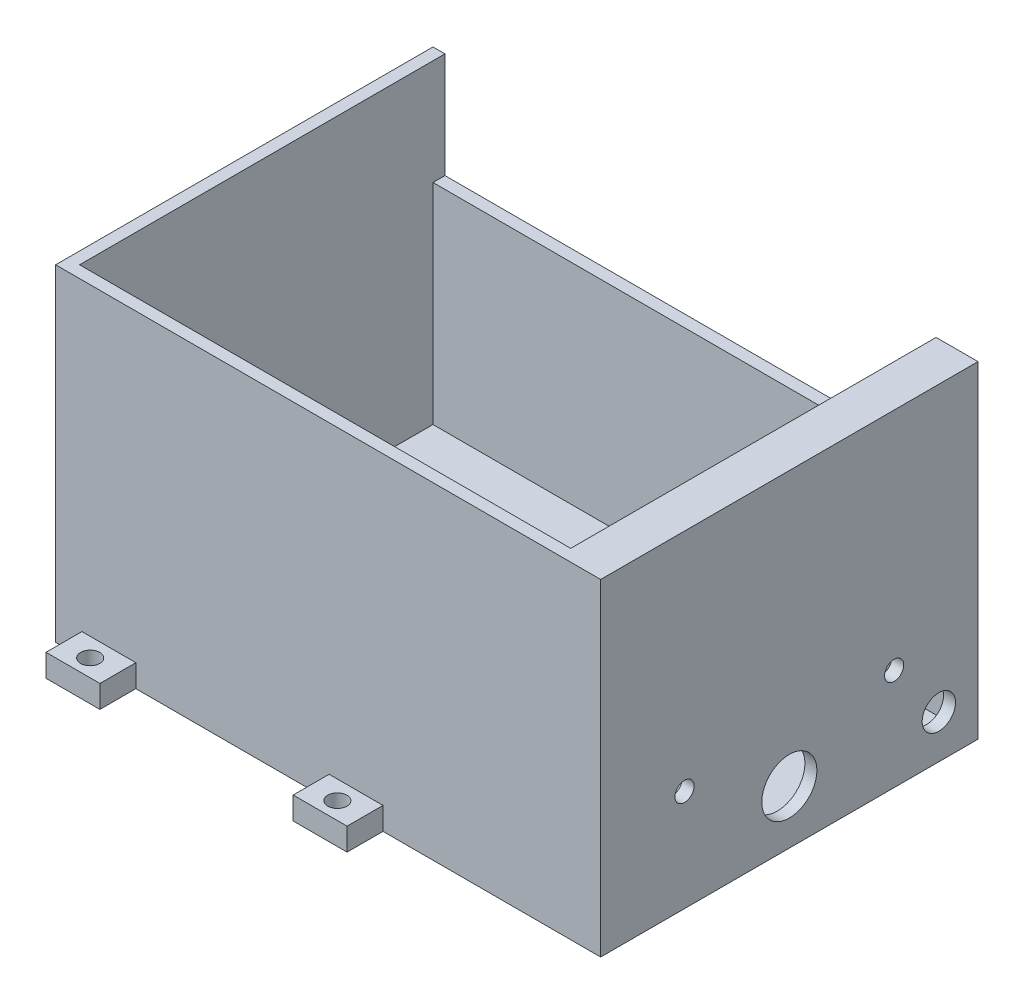
from build123d import *

# Parameters (mm, degrees)
SKETCH_1_W                = 86
SKETCH_1_H                = 63
EXTRUDE_1_DEPTH           = 2
SKETCH_2_W                = 86
SKETCH_2_H                = 63
SKETCH_2_W_2              = 82
SKETCH_2_H_2              = 59
EXTRUDE_3_DEPTH           = 52.6
SKETCH_4_W                = 82
SKETCH_4_H                = 17.6
CUT_EXTRUDE_1_DEPTH       = 52.6
SKETCH_5_R                = 1.6
SKETCH_5_R_2              = 4.6
CUT_EXTRUDE_2_DEPTH       = 2
SKETCH_7_R                = 1.6
CUT_EXTRUDE_6_DEPTH       = 2
SKETCH_8_R                = 1.6
SKETCH_8_R_2              = 1.516132991
CUT_EXTRUDE_7_DEPTH       = 2
SKETCH_9_W                = 63
SKETCH_9_H                = 54.6
EXTRUDE_4_DEPTH           = 5
SKETCH_10_R               = 1.6
SKETCH_10_R_2             = 4.6
CUT_EXTRUDE_8_DEPTH       = 5
CUT_EXTRUDE_START         = -5
SKETCH_11_R               = 1.6
SKETCH_11_R_2             = 4.6
CUT_EXTRUDE_9_DEPTH       = 5
SKETCH_12_W               = 5
SKETCH_12_H               = 15.6
EXTRUDE_5_DEPTH           = 2
SKETCH_13_R               = 2.787491564
CUT_EXTRUDE_10_DEPTH      = 2
SKETCH_14_R               = 3
CUT_EXTRUDE_11_DEPTH      = 2
SKETCH_16_W               = 9
SKETCH_16_H               = 3.75891244
SKETCH_16_H_2             = 3.76
EXTRUDE_6_DEPTH           = 6
CUT_EXTRUDE_15_DEPTH      = 80.341453127
CUT_EXTRUDE_15_DEPTH_BACK = 80.341453127
SKETCH_17_R               = 1.6
SKETCH_18_W               = 9
SKETCH_18_H               = 6
SKETCH_18_R               = 1.6
EXTRUDE_7_DEPTH           = 3.76


with BuildPart() as part:
    # 草图1 → 凸台-拉伸1 (new body)
    with BuildSketch(Plane(origin=(0, 0, 0), x_dir=(1, 0, 0), z_dir=(0, 1, 0))):
        Rectangle(SKETCH_1_W, SKETCH_1_H)
    extrude(amount=EXTRUDE_1_DEPTH)

    # 草图2 → 凸台-拉伸3 (add)
    with BuildSketch(Plane(origin=(0, 2, 0), x_dir=(1, 0, 0), z_dir=(0, 1, 0))):
        Rectangle(SKETCH_2_W, SKETCH_2_H)
        Rectangle(SKETCH_2_W_2, SKETCH_2_H_2, mode=Mode.SUBTRACT)
    extrude(amount=EXTRUDE_3_DEPTH)

    # 草图4 → 切除-拉伸1 (cut)
    with BuildSketch(Plane.XY.offset(-29.5)):
        with Locations((0, 45.8)):
            Rectangle(SKETCH_4_W, SKETCH_4_H)
    extrude(amount=-CUT_EXTRUDE_1_DEPTH, mode=Mode.SUBTRACT)

    # 草图5 → 切除-拉伸2 (cut)
    with BuildSketch(Plane(origin=(43, 0, 0), x_dir=(0, 0, -1), z_dir=(1, 0, 0))):
        with Locations((-17.5, 16.95452537)):
            Circle(SKETCH_5_R)
        with Locations((17.5, 16.95452537)):
            Circle(SKETCH_5_R)
        with Locations((0, 8.95452537)):
            Circle(SKETCH_5_R_2)
    extrude(amount=-CUT_EXTRUDE_2_DEPTH, mode=Mode.SUBTRACT)

    # 草图7 → 切除-拉伸6 (cut)
    with BuildSketch(Plane(origin=(0, 2, 0), x_dir=(1, 0, 0), z_dir=(0, 1, 0))):
        with Locations(Location((-38.17, 6.16, 0), (0, 0, 270))):
            Circle(SKETCH_7_R)
        with Locations(Location((-38.17, -26.73, 0), (0, 0, 270))):
            Circle(SKETCH_7_R)
        with Locations(Location((36.38, -26.73, 0), (0, 0, 270))):
            Circle(SKETCH_7_R)
    extrude(amount=-CUT_EXTRUDE_6_DEPTH, mode=Mode.SUBTRACT)

    # 草图8 → 切除-拉伸7 (cut)
    with BuildSketch(Plane(origin=(0, 2, 0), x_dir=(1, 0, 0), z_dir=(0, 1, 0))):
        with Locations(Location((-39, 1.715, 0), (0, 0, 270))):
            Circle(SKETCH_8_R)
        with Locations(Location((21, -22.285, 0), (0, 0, 270))):
            Circle(SKETCH_8_R)
        with Locations(Location((-39, -22.285, 0), (0, 0, 270))):
            Circle(SKETCH_8_R_2)
        with Locations(Location((21, 1.715, 0), (0, 0, 270))):
            Circle(SKETCH_8_R)
    extrude(amount=-CUT_EXTRUDE_7_DEPTH, mode=Mode.SUBTRACT)

    # 草图9 → 凸台-拉伸4 (add)
    with BuildSketch(Plane(origin=(43, 0, 0), x_dir=(0, 0, -1), z_dir=(1, 0, 0))):
        with Locations((0, 27.3)):
            Rectangle(SKETCH_9_W, SKETCH_9_H)
    extrude(amount=EXTRUDE_4_DEPTH)

    # 草图10 → 切除-拉伸8 (cut)
    with BuildSketch(Plane(origin=(48, 0, 0), x_dir=(0, 0, -1), z_dir=(1, 0, 0))):
        with Locations((-17.5, 16.95452537)):
            Circle(SKETCH_10_R)
        with Locations((0, 8.95452537)):
            Circle(SKETCH_10_R_2)
        with Locations((17.5, 16.95452537)):
            Circle(SKETCH_10_R)
    extrude(amount=-CUT_EXTRUDE_8_DEPTH, mode=Mode.SUBTRACT)

    # 草图11 → 切除-拉伸9 (cut)
    with BuildSketch(Plane.ZY.offset(-41).offset(CUT_EXTRUDE_START)):
        Polygon((29.5, 52.6), (-31.5, 52.6), (-31.5, 37), (-29.5, 37), (-29.5, 2), (29.5, 2), align=None)
        with Locations(Location((-17.5, 16.95452537, 0), (0, 0, 180))):
            Circle(SKETCH_11_R, mode=Mode.SUBTRACT)
        with Locations(Location((0, 8.95452537, 0), (0, 0, 180))):
            Circle(SKETCH_11_R_2, mode=Mode.SUBTRACT)
        with Locations(Location((17.5, 16.95452537, 0), (0, 0, 180))):
            Circle(SKETCH_11_R, mode=Mode.SUBTRACT)
    extrude(amount=CUT_EXTRUDE_9_DEPTH, mode=Mode.SUBTRACT)

    # 草图12 → 凸台-拉伸5 (add)
    with BuildSketch(Plane(origin=(0, 0, -31.5), x_dir=(-1, 0, 0), z_dir=(0, 0, -1))):
        with Locations((-43.5, 44.8)):
            Rectangle(SKETCH_12_W, SKETCH_12_H)
    extrude(amount=-EXTRUDE_5_DEPTH)

    # 草图13 → 切除-拉伸10 (cut)
    with BuildSketch(Plane(origin=(48, 0, 0), x_dir=(0, 0, -1), z_dir=(1, 0, 0))):
        with Locations((24.963130904, 7.208902204)):
            Circle(SKETCH_13_R)
    extrude(amount=-CUT_EXTRUDE_10_DEPTH, mode=Mode.SUBTRACT)

    # 草图14 → 切除-拉伸11 (cut)
    with BuildSketch(Plane(origin=(0, 0, -31.5), x_dir=(-1, 0, 0), z_dir=(0, 0, -1))):
        with Locations((-28.059363277, 7.365425106)):
            Circle(SKETCH_14_R)
    extrude(amount=-CUT_EXTRUDE_11_DEPTH, mode=Mode.SUBTRACT)

    # 草图16 → 凸台-拉伸6 (add)
    with BuildSketch(Plane(origin=(0, 0, -31.5), x_dir=(-1, 0, 0), z_dir=(0, 0, -1))):
        with Locations((34.110668407, 1.87945622)):
            Rectangle(SKETCH_16_W, SKETCH_16_H)
        with Locations((-7.158197826, 1.88)):
            Rectangle(SKETCH_16_W, SKETCH_16_H_2)
    extrude(amount=EXTRUDE_6_DEPTH)

    # 草图17 → 切除-拉伸15 (cut, two sides: drawn at the far end of the back side and taken through both)
    with BuildSketch(Plane(origin=(0, 3.75891244, 0), x_dir=(1, 0, 0), z_dir=(0, 1, 0)).offset(-CUT_EXTRUDE_15_DEPTH_BACK)):
        with Locations(Location((-34.110668407, 34.625200871, 0), (0, 0, 180))):
            Circle(SKETCH_17_R)
        with Locations(Location((7.158197826, 34.625200871, 0), (0, 0, 180))):
            Circle(SKETCH_17_R)
    extrude(amount=CUT_EXTRUDE_15_DEPTH + CUT_EXTRUDE_15_DEPTH_BACK, mode=Mode.SUBTRACT)

    # 草图18 → 凸台-拉伸7 (add)
    # profile 1 of 2: a face of its own
    with BuildSketch(Plane.XZ):
        with Locations((7.158197826, 34.5)):
            Rectangle(SKETCH_18_W, SKETCH_18_H)
        with Locations(Location((7.158197826, 34.625200871, 0), (0, 0, 270))):
            Circle(SKETCH_18_R, mode=Mode.SUBTRACT)
    # profile 2 of 2: a face of its own
    with BuildSketch(Plane.XZ):
        with Locations((-34.110668407, 34.5)):
            Rectangle(SKETCH_18_W, SKETCH_18_H)
        with Locations(Location((-34.110668407, 34.625200871, 0), (0, 0, 270))):
            Circle(SKETCH_18_R, mode=Mode.SUBTRACT)
    extrude(amount=-EXTRUDE_7_DEPTH)


solid = part.part
